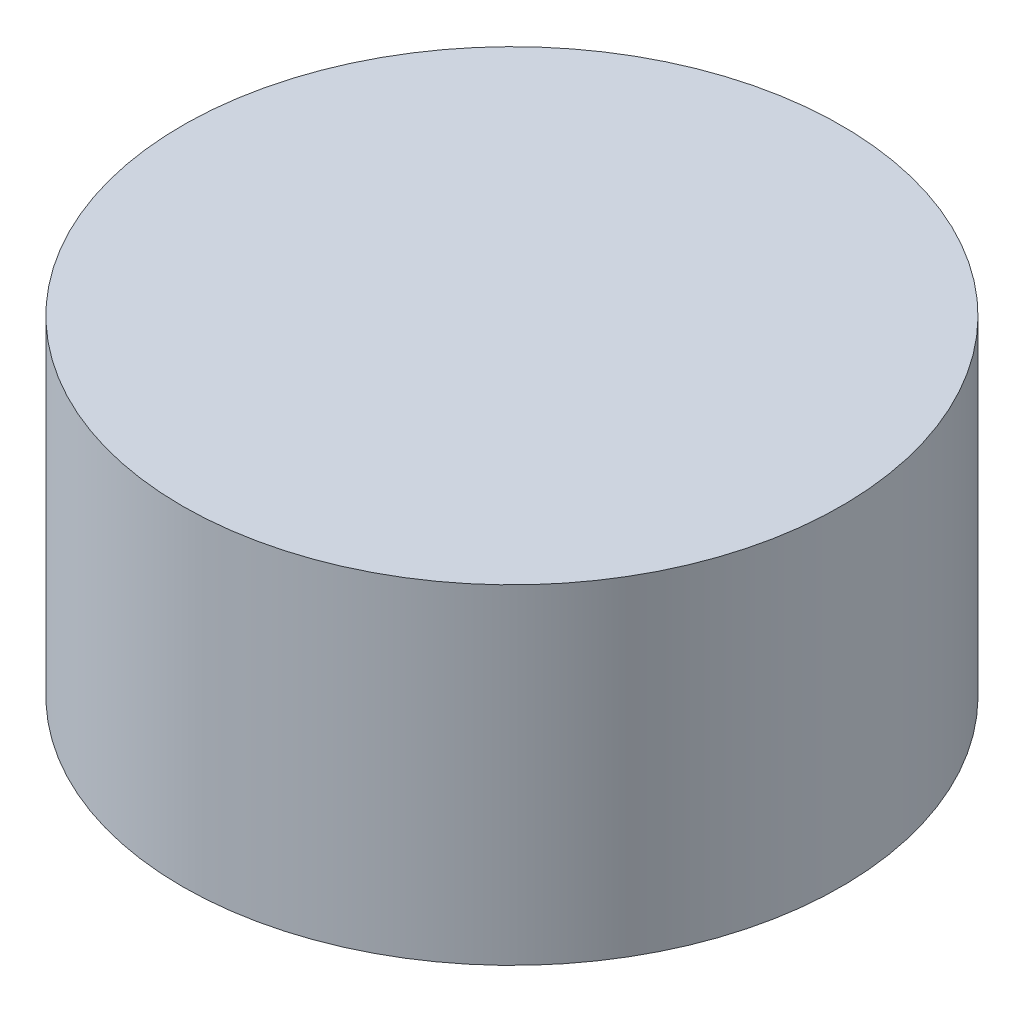
from build123d import *

# Parameters (mm, degrees)
KOLA1L_OMUZ_D70_START = 190
SKETCH1_R             = 35
KOLA1L_OMUZ_D70_DEPTH = 35


with BuildPart() as part:
    # Sketch1 → KOLA1L_omuz_D70 (new body)
    with BuildSketch(Plane(origin=(0, 0, 0), x_dir=(1, 0, 0), z_dir=(0, 1, 0)).offset(KOLA1L_OMUZ_D70_START)):
        with Locations(Location((0, 0, 0), (0, 0, 270))):
            Circle(SKETCH1_R)
    extrude(amount=KOLA1L_OMUZ_D70_DEPTH)


solid = part.part
